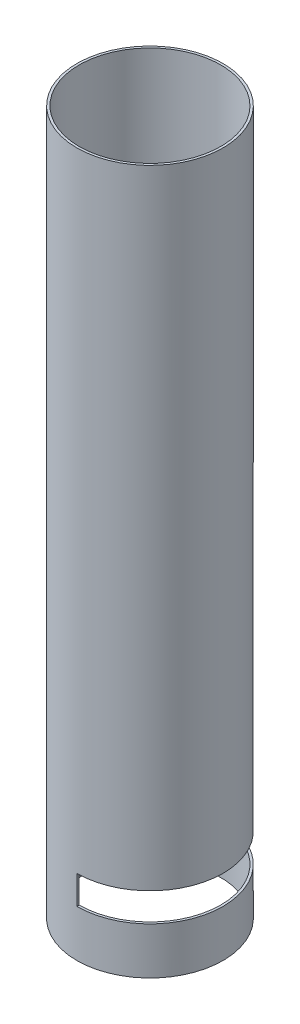
from build123d import *

# Parameters (mm, degrees)
SKETCH1_R           = 31.165
SKETCH1_R_2         = 30.1625
BOSS_EXTRUDE1_DEPTH = 150
SKETCH2_W           = 31.165
SKETCH2_H           = 62.33
SLOT_DEPTH          = 12.2


with BuildPart() as part:
    # Sketch1 → Boss-Extrude1 (new, symmetric)
    with BuildSketch(Plane(origin=(0, 0, 0), x_dir=(1, 0, 0), z_dir=(0, 1, 0))):
        with Locations(Location((0, 0, 0), (0, 0, 270))):
            Circle(SKETCH1_R)
        with Locations(Location((0, 0, 0), (0, 0, 270))):
            Circle(SKETCH1_R_2, mode=Mode.SUBTRACT)
    extrude(amount=BOSS_EXTRUDE1_DEPTH, both=True)

    # Sketch2 → Slot (cut)
    with BuildSketch(Plane(origin=(0, -130, 0), x_dir=(-1, 0, 0), z_dir=(0, -1, 0))):
        with Locations((-15.5825, 0)):
            Rectangle(SKETCH2_W, SKETCH2_H)
    extrude(amount=-SLOT_DEPTH, mode=Mode.SUBTRACT)


solid = part.part
